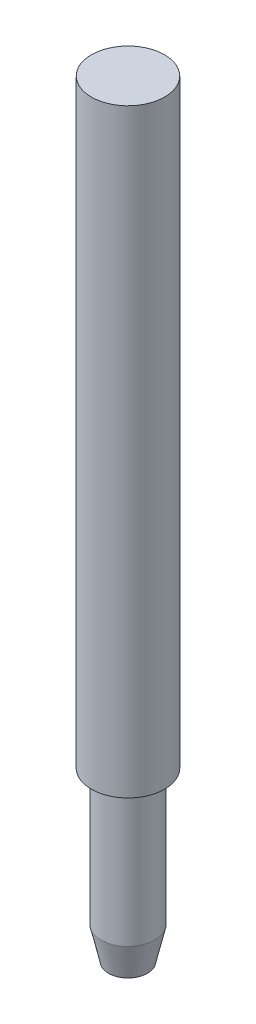
from build123d import *

# Parameters (mm, degrees)
SKETCH1_R           = 2.38125
BOSS_EXTRUDE1_DEPTH = 38.9763
SKETCH2_R           = 1.7526
BOSS_EXTRUDE2_DEPTH = 10.922


with BuildPart() as part:
    # Sketch1 → Boss-Extrude1 (new body)
    with BuildSketch(Plane(origin=(0, 0, 0), x_dir=(1, 0, 0), z_dir=(0, 1, 0))):
        with Locations(Location((0, 0, 0), (0, 0, 270))):
            Circle(SKETCH1_R)
    extrude(amount=BOSS_EXTRUDE1_DEPTH)

    # Sketch2 → Boss-Extrude2 (add)
    with BuildSketch(Plane.XZ):
        with Locations(Location((0, 0, 0), (0, 0, 270))):
            Circle(SKETCH2_R)
    extrude(amount=BOSS_EXTRUDE2_DEPTH)

    # Sketch3 → Cut-Revolve1 (revolve, cut)
    with BuildSketch(Plane(origin=(0, 0, 0), x_dir=(0, 0, -1), z_dir=(1, 0, 0)), mode=Mode.PRIVATE) as cut_revolve1_sk:
        Polygon((1.7526, -8.805333333), (1.27, -10.922), (1.7526, -10.922), align=None)
    revolve(cut_revolve1_sk.sketch.rotate(Axis((0, -10.922, 0), (0, 1, 0)), 180), axis=Axis((0, -10.922, 0), (0, 1, 0)), mode=Mode.SUBTRACT)


solid = part.part
